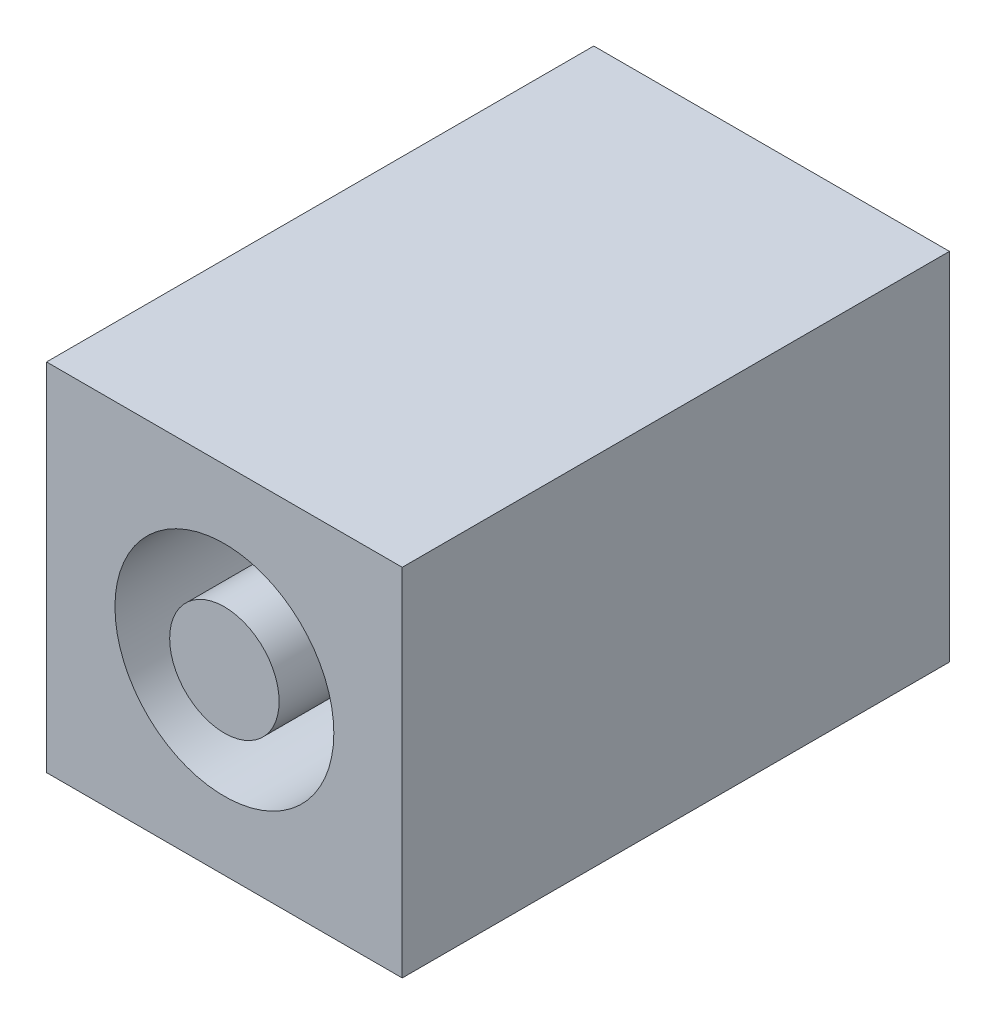
from build123d import *

# Parameters (mm, degrees)
SKETCH_1_W        = 130
SKETCH_1_H        = 130
SKETCH_1_R        = 40
EXTRUDE_1_DEPTH   = 200
SKETCH_1_R_2      = 20
EXTRUDE_1_2_DEPTH = 200
SKETCH_2_W        = 130
SKETCH_2_H        = 130
EXTRUDE_2_DEPTH   = 3


with BuildPart() as part:
    # 스케치1 → 보스-돌출1 (new body)
    with BuildSketch(Plane.XY):
        Rectangle(SKETCH_1_W, SKETCH_1_H)
        Circle(SKETCH_1_R, mode=Mode.SUBTRACT)
    extrude(amount=EXTRUDE_1_DEPTH)



with BuildPart() as body_2:
    # 스케치1 → Extrude 1 2 (new body)
    with BuildSketch(Plane.XY):
        Circle(SKETCH_1_R_2)
    extrude(amount=EXTRUDE_1_2_DEPTH)


with BuildPart() as part_1:
    add(part.part)

    add(body_2.part)  # 보스-돌출2 merges body 2
    # 스케치2 → 보스-돌출2 (add)
    with BuildSketch(Plane(origin=(0, 0, 0), x_dir=(-1, 0, 0), z_dir=(0, 0, -1))):
        Rectangle(SKETCH_2_W, SKETCH_2_H)
    extrude(amount=-EXTRUDE_2_DEPTH)


solid = part_1.part
